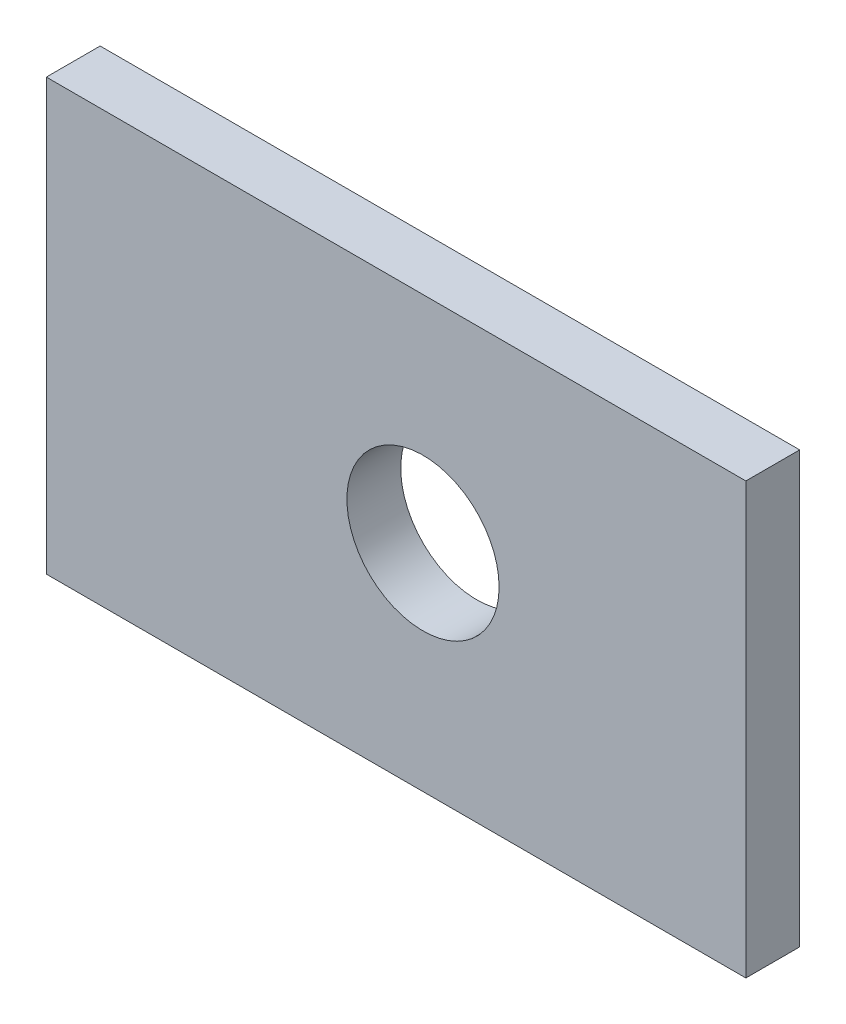
from build123d import *

# Parameters (mm, degrees)
SKETCH_1_W      = 130
SKETCH_1_H      = 80
SKETCH_1_R      = 14.142135624
EXTRUDE_1_DEPTH = 10


with BuildPart() as part:
    # 草图1 → 凸台-拉伸1 (new body)
    with BuildSketch(Plane.XY):
        with Locations((15, -10)):
            Rectangle(SKETCH_1_W, SKETCH_1_H)
        with Locations((20, -10)):
            Circle(SKETCH_1_R, mode=Mode.SUBTRACT)
    extrude(amount=EXTRUDE_1_DEPTH)


solid = part.part
